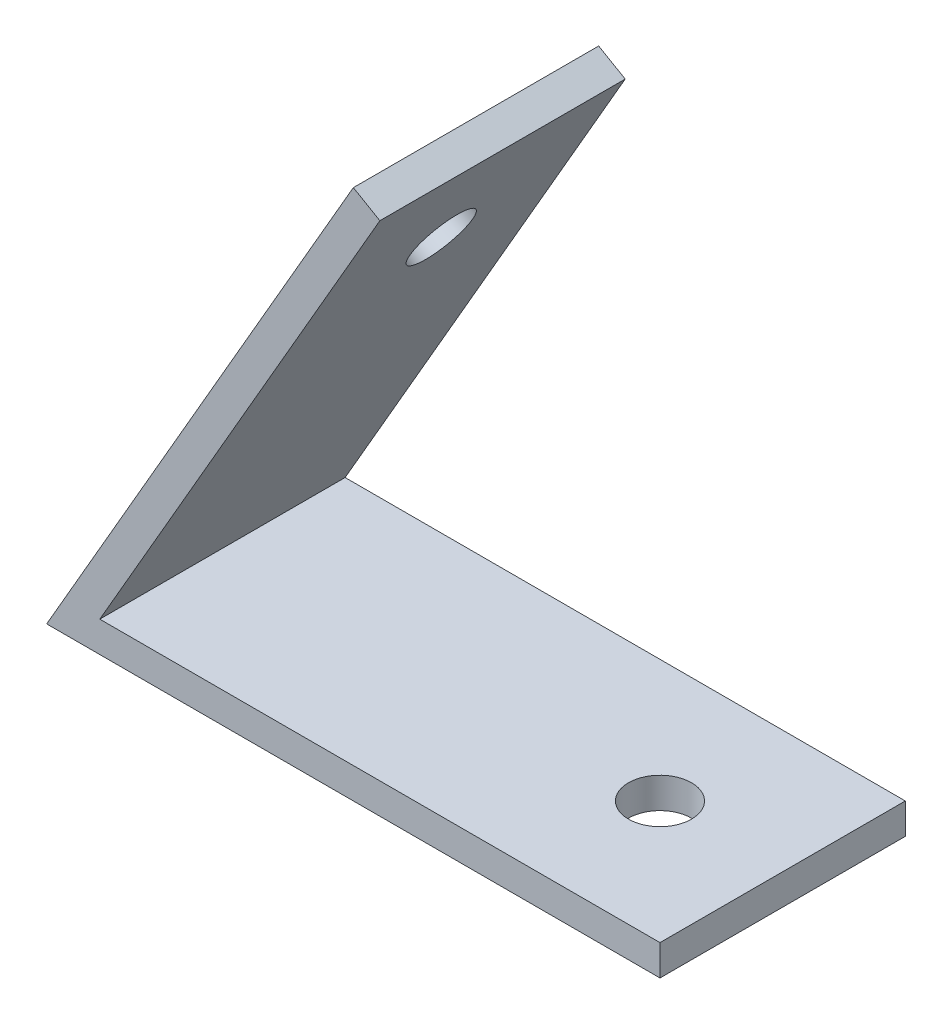
from build123d import *

# Parameters (mm, degrees)
BOSS_EXTRUDE1_DEPTH             = 12.7
F_4_CLEARANCE_HOLE1_D           = 3.2639
F_4_CLEARANCE_HOLE1_ON_FACE_2_D = 3.2639


with BuildPart() as part:
    # Sketch1 → Boss-Extrude1 (new body)
    with BuildSketch(Plane.XY):
        Polygon((0, 0), (31.75, 0), (31.75, 1.5875), (2.749630657, 1.5875), (17.249815329, 26.70255657), (15.875, 27.49630657), align=None)
    extrude(amount=BOSS_EXTRUDE1_DEPTH)

    # #4 Clearance Hole1 (through all)
    with Locations(Plane(origin=(12.7, 21.997045256, 6.35), x_dir=(-0.5, -0.866025403784, 0), z_dir=(-0.866025403784, 0.5, 0))):
        with Locations((0, 0)):
            Hole(F_4_CLEARANCE_HOLE1_D / 2)

    # #4 Clearance Hole1 on face 2 (through all)
    with Locations(Plane(origin=(25.4, 0, 6.35), x_dir=(0, 0, -1), z_dir=(0, -1, 0))):
        with Locations((0, 0)):
            Hole(F_4_CLEARANCE_HOLE1_ON_FACE_2_D / 2)


solid = part.part
